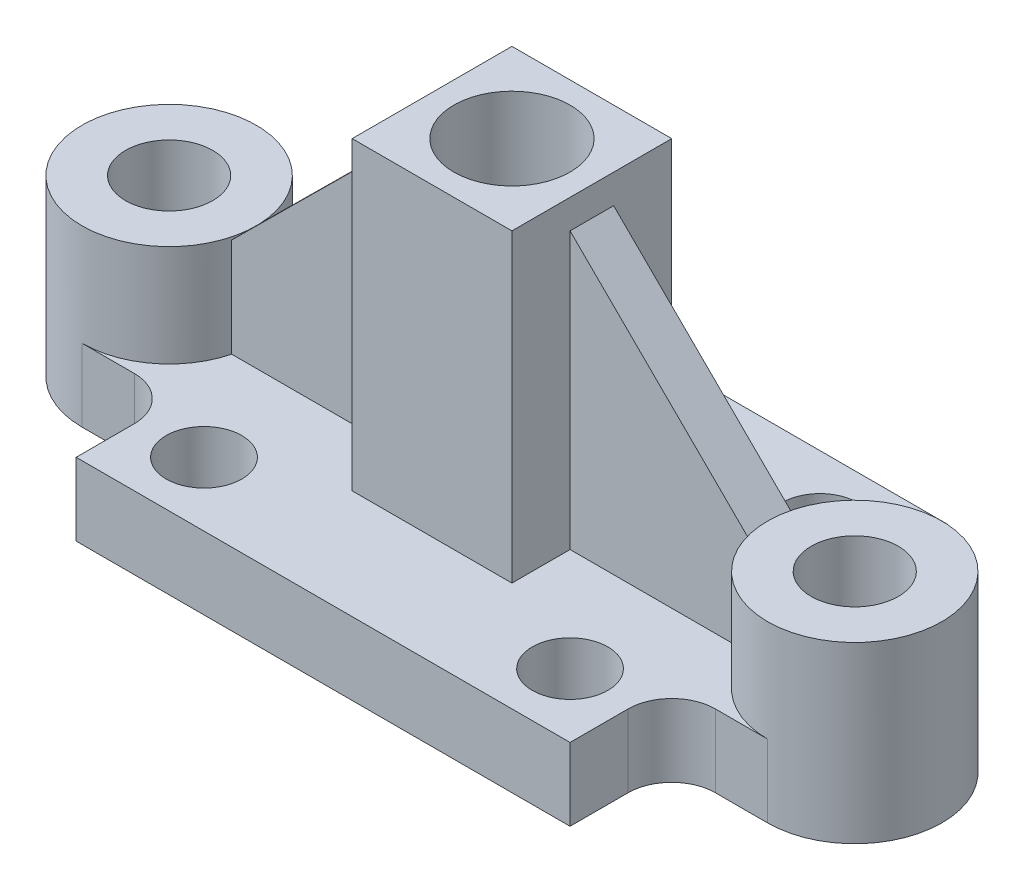
from build123d import *

# Parameters (mm, degrees)
BOSS_EXTRUDE1_DEPTH      = 12.5
BOSS_EXTRUDE2_DEPTH      = 47.5
BOSS_EXTRUDE2_DEPTH_BACK = 12.5
SKETCH1_3_R              = 30
SKETCH1_3_R_2            = 15
CUT_EXTRUDE1_REACH       = 167.39
SKETCH2_R                = 13
SKETCH3_W                = 55
SKETCH3_H                = 55
BOSS_EXTRUDE3_DEPTH      = 105
CUT_EXTRUDE2_REACH       = 209.434
SKETCH4_R                = 20
BOSS_EXTRUDE5_DEPTH      = 7.5


with BuildPart() as part:
    # Sketch1 → Boss-Extrude1 (new, symmetric)
    with BuildSketch(Plane(origin=(0, 0, 0), x_dir=(1, 0, 0), z_dir=(0, 1, 0))):
        with BuildLine():
            ThreePointArc((118, -30), (88, 0), (118, 30))
            Line((118, 30), (100, 30))
            ThreePointArc((100, 30), (89.393398282, 34.393398282), (85, 45))
            Line((85, 45), (85, 65))
            Line((85, 65), (-85, 65))
            Line((-85, 65), (-85, 45))
            ThreePointArc((-85, 45), (-89.393398282, 34.393398282), (-100, 30))
            Line((-100, 30), (-118, 30))
            ThreePointArc((-118, 30), (-96.786796564, 21.213203436), (-88, 0))
            ThreePointArc((-88, 0), (-96.786796564, -21.213203436), (-118, -30))
            Line((-118, -30), (-100, -30))
            ThreePointArc((-100, -30), (-89.393398282, -34.393398282), (-85, -45))
            Line((-85, -45), (-85, -65))
            Line((-85, -65), (85, -65))
            Line((85, -65), (85, -45))
            ThreePointArc((85, -45), (89.393398282, -34.393398282), (100, -30))
            Line((100, -30), (118, -30))
        make_face()
    extrude(amount=BOSS_EXTRUDE1_DEPTH, both=True)

    # Sketch1<3> → Boss-Extrude2 (add, two sides: drawn at the far end of the back side and taken through both)
    # profile 1 of 2: a face of its own
    with BuildSketch(Plane(origin=(0, 0, 0), x_dir=(1, 0, 0), z_dir=(0, 1, 0)).offset(-BOSS_EXTRUDE2_DEPTH_BACK)):
        with Locations(Location((-118, 0, 0), (0, 0, 270))):
            Circle(SKETCH1_3_R)
        with Locations(Location((-118, 0, 0), (0, 0, 270))):
            Circle(SKETCH1_3_R_2, mode=Mode.SUBTRACT)
    # profile 2 of 2: a face of its own
    with BuildSketch(Plane(origin=(0, 0, 0), x_dir=(1, 0, 0), z_dir=(0, 1, 0)).offset(-BOSS_EXTRUDE2_DEPTH_BACK)):
        with Locations(Location((118, 0, 0), (0, 0, 270))):
            Circle(SKETCH1_3_R)
        with Locations(Location((118, 0, 0), (0, 0, 270))):
            Circle(SKETCH1_3_R_2, mode=Mode.SUBTRACT)
    extrude(amount=BOSS_EXTRUDE2_DEPTH + BOSS_EXTRUDE2_DEPTH_BACK)

    # Sketch2 → Cut-Extrude1 (cut, up to next)
    with BuildSketch(Plane(origin=(0, 12.5, 0), x_dir=(1, 0, 0), z_dir=(0, 1, 0)), mode=Mode.PRIVATE) as cut_extrude1_sk1:
        with Locations(Location((-63, 43, 0), (0, 0, 270))):
            Circle(SKETCH2_R)
    cut_extrude1_tool1 = extrude(cut_extrude1_sk1.sketch, amount=-CUT_EXTRUDE1_REACH, mode=Mode.PRIVATE) & part.part
    # Sketch2 → Cut-Extrude1 (cut, up to next)
    with BuildSketch(Plane(origin=(0, 12.5, 0), x_dir=(1, 0, 0), z_dir=(0, 1, 0)), mode=Mode.PRIVATE) as cut_extrude1_sk2:
        with Locations(Location((-63, -43, 0), (0, 0, 270))):
            Circle(SKETCH2_R)
    cut_extrude1_tool2 = extrude(cut_extrude1_sk2.sketch, amount=-CUT_EXTRUDE1_REACH, mode=Mode.PRIVATE) & part.part
    # Sketch2 → Cut-Extrude1 (cut, up to next)
    with BuildSketch(Plane(origin=(0, 12.5, 0), x_dir=(1, 0, 0), z_dir=(0, 1, 0)), mode=Mode.PRIVATE) as cut_extrude1_sk3:
        with Locations(Location((63, 43, 0), (0, 0, 270))):
            Circle(SKETCH2_R)
    cut_extrude1_tool3 = extrude(cut_extrude1_sk3.sketch, amount=-CUT_EXTRUDE1_REACH, mode=Mode.PRIVATE) & part.part
    # Sketch2 → Cut-Extrude1 (cut, up to next)
    with BuildSketch(Plane(origin=(0, 12.5, 0), x_dir=(1, 0, 0), z_dir=(0, 1, 0)), mode=Mode.PRIVATE) as cut_extrude1_sk4:
        with Locations(Location((63, -43, 0), (0, 0, 270))):
            Circle(SKETCH2_R)
    cut_extrude1_tool4 = extrude(cut_extrude1_sk4.sketch, amount=-CUT_EXTRUDE1_REACH, mode=Mode.PRIVATE) & part.part
    add(cut_extrude1_tool1.solids().sort_by_distance((-63, 12.5, -43))[0], mode=Mode.SUBTRACT)
    add(cut_extrude1_tool2.solids().sort_by_distance((-63, 12.5, 43))[0], mode=Mode.SUBTRACT)
    add(cut_extrude1_tool3.solids().sort_by_distance((63, 12.5, -43))[0], mode=Mode.SUBTRACT)
    add(cut_extrude1_tool4.solids().sort_by_distance((63, 12.5, 43))[0], mode=Mode.SUBTRACT)

    # Sketch3 → Boss-Extrude3 (add)
    with BuildSketch(Plane(origin=(0, 12.5, 0), x_dir=(1, 0, 0), z_dir=(0, 1, 0))):
        Rectangle(SKETCH3_W, SKETCH3_H)
    extrude(amount=BOSS_EXTRUDE3_DEPTH)

    # Sketch4 → Cut-Extrude2 (cut, up to next)
    with BuildSketch(Plane(origin=(0, 117.5, 0), x_dir=(1, 0, 0), z_dir=(0, 1, 0)), mode=Mode.PRIVATE) as cut_extrude2_sk1:
        with Locations(Location((0, 0, 0), (0, 0, 270))):
            Circle(SKETCH4_R)
    cut_extrude2_tool1 = extrude(cut_extrude2_sk1.sketch, amount=-CUT_EXTRUDE2_REACH, mode=Mode.PRIVATE) & part.part
    add(cut_extrude2_tool1.solids().sort_by_distance((0, 117.5, 0))[0], mode=Mode.SUBTRACT)


with BuildPart() as body_2:
    # Sketch6 → Boss-Extrude5 (new, symmetric)
    with BuildSketch(Plane.XY):
        Polygon((-89.168947092, 12.5), (-89.168947092, 46.340713627), (-27.5, 107.5), (-27.5, 12.5), align=None)
    extrude(amount=BOSS_EXTRUDE5_DEPTH, both=True)


with BuildPart() as body_3:
    # Mirror6: mirrored copy
    add(body_2.part.mirror(Plane(origin=(0, 0, 0), x_dir=(0, 0, 1), z_dir=(1, 0, 0))))


solid = Compound([part.part, body_2.part, body_3.part])
